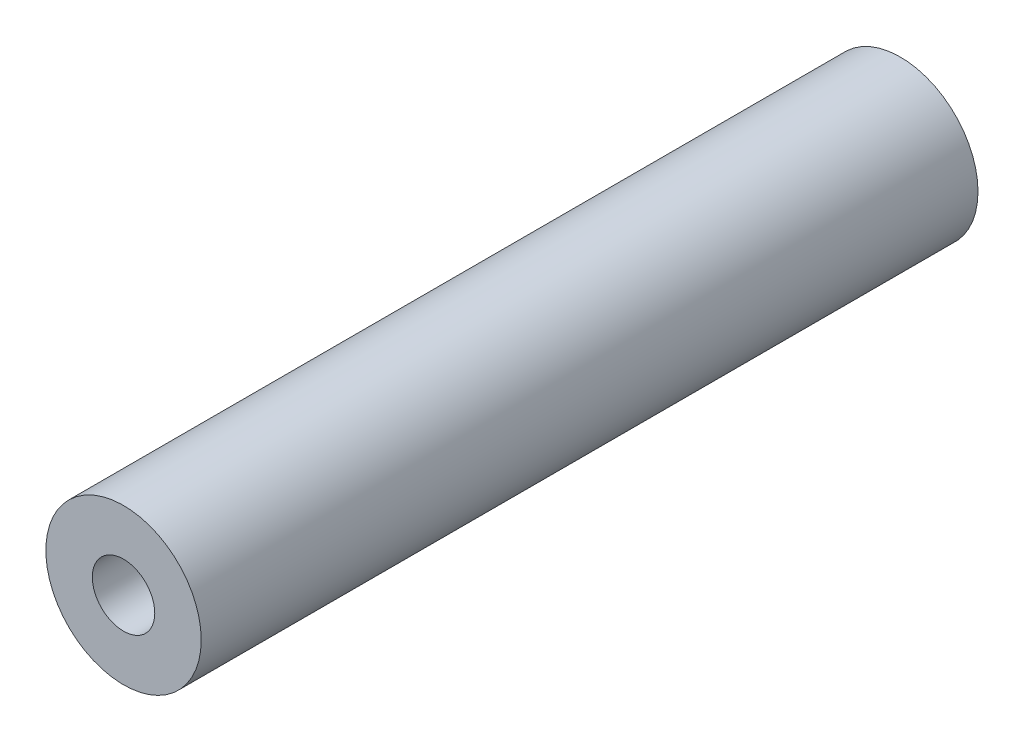
from build123d import *

# Parameters (mm, degrees)
SKETCH1_R                             = 6.35
BOSS_EXTRUDE1_DEPTH                   = 31.75
F_1_4_20_TAPPED_HOLE1_D               = 5.1054
F_1_4_20_TAPPED_HOLE1_DEPTH           = 16.51
F_1_4_20_TAPPED_HOLE1_TIP             = 1.533816902
F_1_4_20_TAPPED_HOLE1_ON_FACE_2_D     = 5.1054
F_1_4_20_TAPPED_HOLE1_ON_FACE_2_DEPTH = 16.51
F_1_4_20_TAPPED_HOLE1_ON_FACE_2_TIP   = 1.533816902


with BuildPart() as part:
    # Sketch1 → Boss-Extrude1 (new, symmetric)
    with BuildSketch(Plane.XY):
        Circle(SKETCH1_R)
    extrude(amount=BOSS_EXTRUDE1_DEPTH, both=True)

    # 1/4-20 Tapped Hole1
    with Locations(Plane.XY.offset(31.75)):
        with Locations((0, 0)):
            Hole(F_1_4_20_TAPPED_HOLE1_D / 2, depth=F_1_4_20_TAPPED_HOLE1_DEPTH)
            with Locations((0, 0, -(F_1_4_20_TAPPED_HOLE1_DEPTH + F_1_4_20_TAPPED_HOLE1_TIP / 2))):  # 118° drill point
                Cone(0, F_1_4_20_TAPPED_HOLE1_D / 2, F_1_4_20_TAPPED_HOLE1_TIP, mode=Mode.SUBTRACT)

    # 1/4-20 Tapped Hole1 on face 2
    with Locations(Plane(origin=(0, 0, -31.75), x_dir=(-1, 0, 0), z_dir=(0, 0, -1))):
        with Locations((0, 0)):
            Hole(F_1_4_20_TAPPED_HOLE1_ON_FACE_2_D / 2, depth=F_1_4_20_TAPPED_HOLE1_ON_FACE_2_DEPTH)
            with Locations((0, 0, -(F_1_4_20_TAPPED_HOLE1_ON_FACE_2_DEPTH + F_1_4_20_TAPPED_HOLE1_ON_FACE_2_TIP / 2))):  # 118° drill point
                Cone(0, F_1_4_20_TAPPED_HOLE1_ON_FACE_2_D / 2, F_1_4_20_TAPPED_HOLE1_ON_FACE_2_TIP, mode=Mode.SUBTRACT)


solid = part.part
